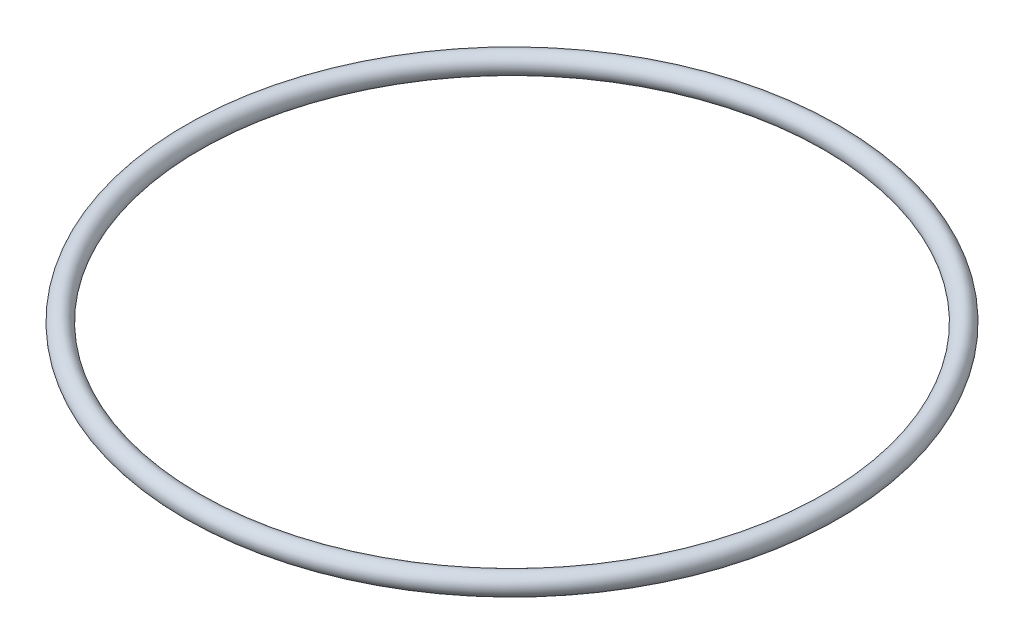
from build123d import *

# Parameters (mm, degrees)
SKETCH1_R = 4.3


with BuildPart() as part:
    # Sketch1 → Revolve1 (revolve)
    with BuildSketch(Plane.XY, mode=Mode.PRIVATE) as revolve1_sk:
        with Locations((135.7, 0)):
            Circle(SKETCH1_R)
    revolve(revolve1_sk.sketch.rotate(Axis((0, 19.79695453, 0), (0, -1, 0)), 90), axis=Axis((0, 19.79695453, 0), (0, -1, 0)))


solid = part.part
